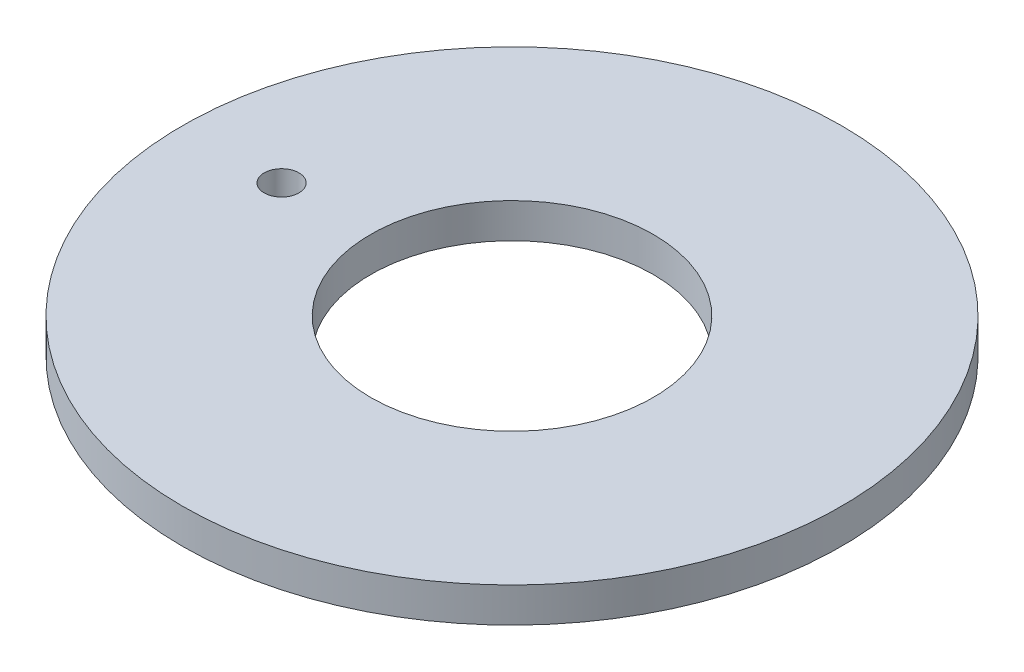
from build123d import *

# Parameters (mm, degrees)
SKETCH1_R           = 37.9
SKETCH1_R_2         = 16.25
BOSS_EXTRUDE1_DEPTH = 4
SKETCH2_R           = 2
CUT_EXTRUDE1_DEPTH  = 54.747744139


with BuildPart() as part:
    # Sketch1 → Boss-Extrude1 (new body)
    with BuildSketch(Plane(origin=(0, 0, 0), x_dir=(1, 0, 0), z_dir=(0, 1, 0))):
        with Locations(Location((0, 0, 0), (0, 0, 270))):
            Circle(SKETCH1_R)
        with Locations(Location((0, 0, 0), (0, 0, 270))):
            Circle(SKETCH1_R_2, mode=Mode.SUBTRACT)
    extrude(amount=BOSS_EXTRUDE1_DEPTH)

    # Sketch2 → Cut-Extrude1 (cut, through all)
    with BuildSketch(Plane(origin=(0, 4, 0), x_dir=(1, 0, 0), z_dir=(0, 1, 0))):
        with Locations(Location((-26.5, 0, 0), (0, 0, 270))):
            Circle(SKETCH2_R)
    extrude(amount=-CUT_EXTRUDE1_DEPTH, mode=Mode.SUBTRACT)


solid = part.part
